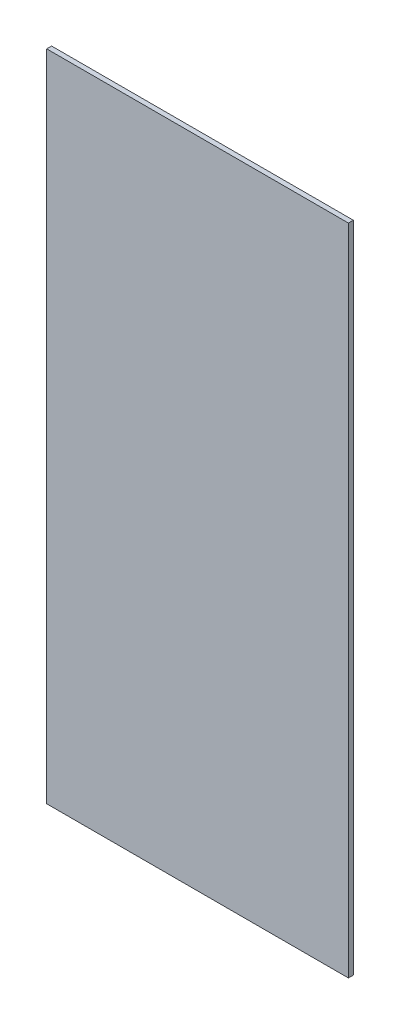
from build123d import *

# Parameters (mm, degrees)
SKETCH_1_W      = 245.98517055
SKETCH_1_H      = 4
EXTRUDE_1_DEPTH = 533


with BuildPart() as part:
    # Эскиз1 → Вытянуть1 (new body)
    with BuildSketch(Plane(origin=(0, 0, 0), x_dir=(1, 0, 0), z_dir=(0, 1, 0))):
        with Locations((122.992585275, -2)):
            Rectangle(SKETCH_1_W, SKETCH_1_H)
    extrude(amount=EXTRUDE_1_DEPTH)


solid = part.part
